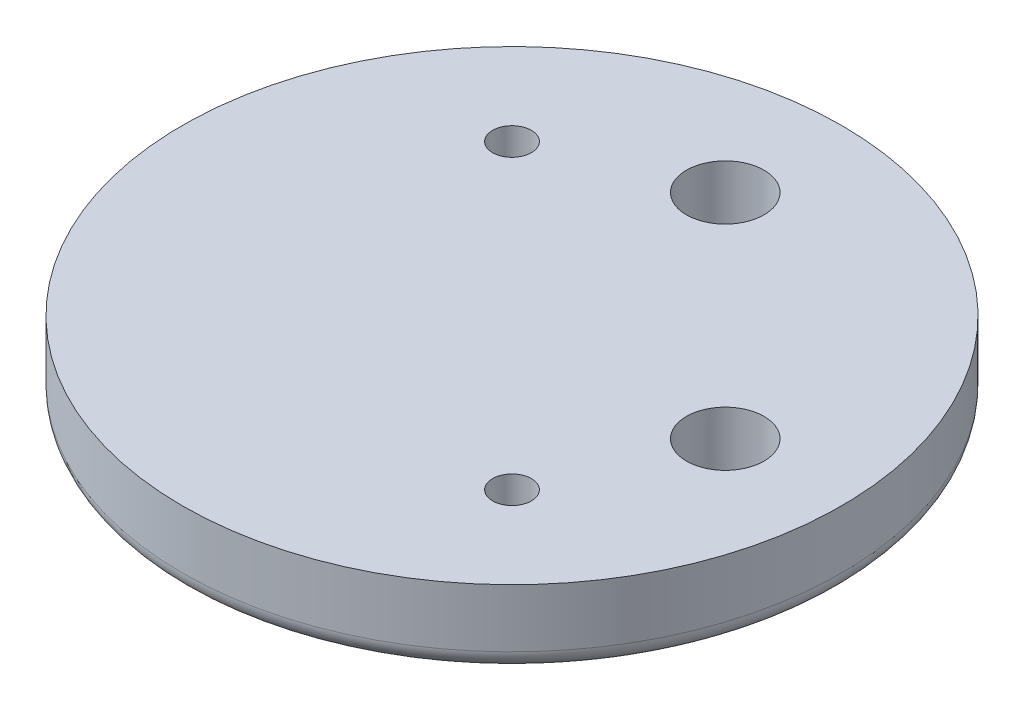
from build123d import *

# Parameters (mm, degrees)
SKETCH_1_R          = 17
EXTRUDE_1_DEPTH     = 4
CUT_EXTRUDE_1_DEPTH = 2
CUT_EXTRUDE_2_REACH = 26.372
SKETCH_3_R          = 2
SKETCH_3_R_2        = 1
FILLET_1_R          = 1


with BuildPart() as part:
    # 草图1 → 凸台-拉伸1 (new body)
    with BuildSketch(Plane(origin=(0, 0, 0), x_dir=(1, 0, 0), z_dir=(0, 1, 0))):
        with Locations(Location((0, 0, 0), (0, 0, 270))):
            Circle(SKETCH_1_R)
    extrude(amount=EXTRUDE_1_DEPTH)

    # 草图2 → 切除-拉伸1 (cut)
    with BuildSketch(Plane(origin=(0, 0, 0), x_dir=(1, 0, 0), z_dir=(0, 1, 0))):
        with BuildLine():
            Line((2.5, 4.5), (2.5, -4.5))
            ThreePointArc((2.5, -4.5), (0, -7), (-2.5, -4.5))
            Line((-2.5, -4.5), (-2.5, 4.5))
            ThreePointArc((-2.5, 4.5), (0, 7), (2.5, 4.5))
        make_face()
    extrude(amount=CUT_EXTRUDE_1_DEPTH, mode=Mode.SUBTRACT)

    # 草图3 → 切除-拉伸2 (cut, up to next)
    with BuildSketch(Plane(origin=(0, 4, 0), x_dir=(1, 0, 0), z_dir=(0, 1, 0)), mode=Mode.PRIVATE) as cut_extrude_2_sk1:
        with Locations(Location((0, 11, 0), (0, 0, 270))):
            Circle(SKETCH_3_R)
    cut_extrude_2_tool1 = extrude(cut_extrude_2_sk1.sketch, amount=-CUT_EXTRUDE_2_REACH, mode=Mode.PRIVATE) & part.part
    # 草图3 → 切除-拉伸2 (cut, up to next)
    with BuildSketch(Plane(origin=(0, 4, 0), x_dir=(1, 0, 0), z_dir=(0, 1, 0)), mode=Mode.PRIVATE) as cut_extrude_2_sk2:
        with Locations(Location((-7.778174593, 7.778174593, 0), (0, 0, 270))):
            Circle(SKETCH_3_R_2)
    cut_extrude_2_tool2 = extrude(cut_extrude_2_sk2.sketch, amount=-CUT_EXTRUDE_2_REACH, mode=Mode.PRIVATE) & part.part
    # 草图3 → 切除-拉伸2 (cut, up to next)
    with BuildSketch(Plane(origin=(0, 4, 0), x_dir=(1, 0, 0), z_dir=(0, 1, 0)), mode=Mode.PRIVATE) as cut_extrude_2_sk3:
        with Locations(Location((11, 0, 0), (0, 0, 270))):
            Circle(SKETCH_3_R)
    cut_extrude_2_tool3 = extrude(cut_extrude_2_sk3.sketch, amount=-CUT_EXTRUDE_2_REACH, mode=Mode.PRIVATE) & part.part
    # 草图3 → 切除-拉伸2 (cut, up to next)
    with BuildSketch(Plane(origin=(0, 4, 0), x_dir=(1, 0, 0), z_dir=(0, 1, 0)), mode=Mode.PRIVATE) as cut_extrude_2_sk4:
        with Locations(Location((7.778174593, -7.778174593, 0), (0, 0, 270))):
            Circle(SKETCH_3_R_2)
    cut_extrude_2_tool4 = extrude(cut_extrude_2_sk4.sketch, amount=-CUT_EXTRUDE_2_REACH, mode=Mode.PRIVATE) & part.part
    add(cut_extrude_2_tool1.solids().sort_by_distance((0, 4, -11))[0], mode=Mode.SUBTRACT)
    add(cut_extrude_2_tool2.solids().sort_by_distance((-7.778175, 4, -7.778175))[0], mode=Mode.SUBTRACT)
    add(cut_extrude_2_tool3.solids().sort_by_distance((11, 4, 0))[0], mode=Mode.SUBTRACT)
    add(cut_extrude_2_tool4.solids().sort_by_distance((7.778175, 4, 7.778175))[0], mode=Mode.SUBTRACT)

    # 圆角1
    fillet_1_edges = [part.edges().sort_by_distance(p)[0] for p in [
        (0, 0, -17),
    ]]
    fillet(fillet_1_edges, radius=FILLET_1_R)


solid = part.part
